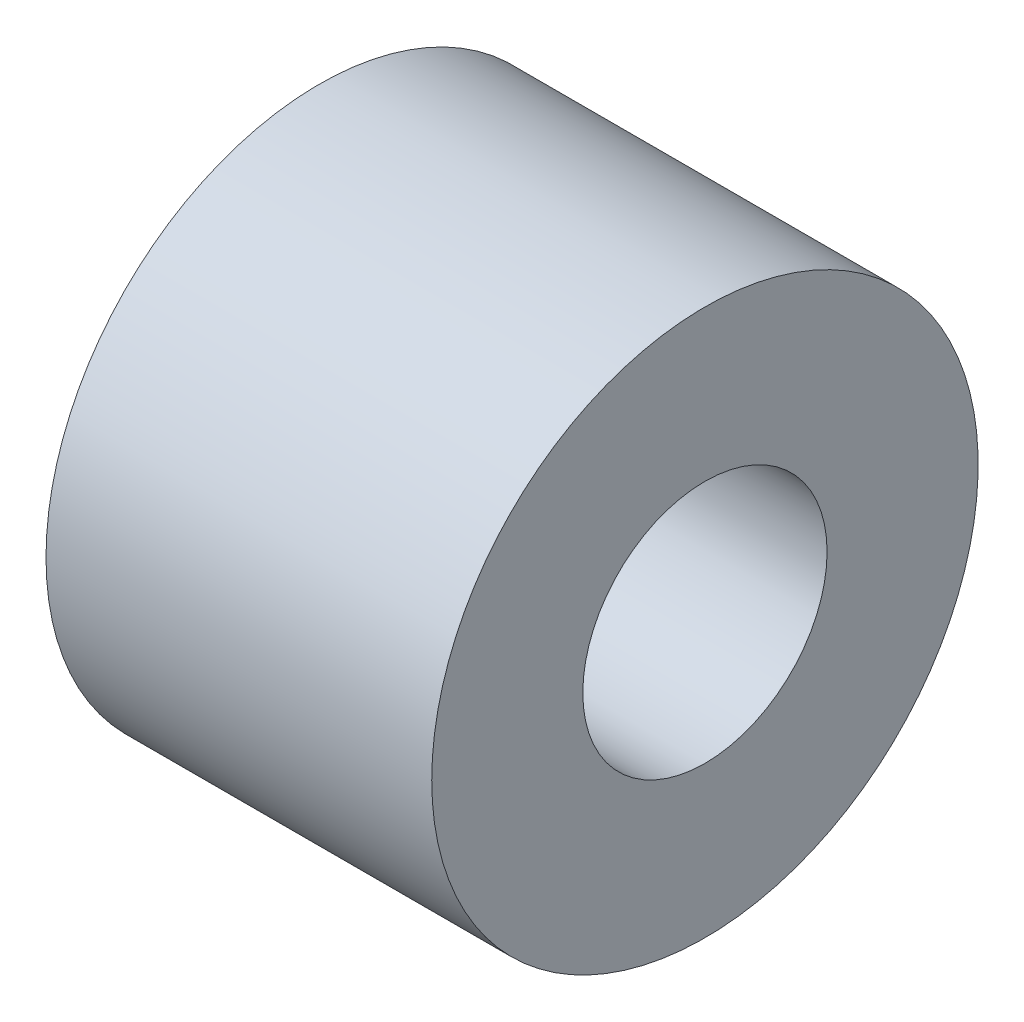
from build123d import *

# Parameters (mm, degrees)
CROQUIS1_R              = 5.3975
CROQUIS1_R_2            = 2.413
SALIENTE_EXTRUIR1_DEPTH = 3.81


with BuildPart() as part:
    # Croquis1 → Saliente-Extruir1 (new, symmetric)
    with BuildSketch(Plane(origin=(0, 0, 0), x_dir=(0, 0, -1), z_dir=(1, 0, 0))):
        with Locations(Location((0, 0, 0), (0, 0, 180))):
            Circle(CROQUIS1_R)
        with Locations(Location((0, 0, 0), (0, 0, 180))):
            Circle(CROQUIS1_R_2, mode=Mode.SUBTRACT)
    extrude(amount=SALIENTE_EXTRUIR1_DEPTH, both=True)


solid = part.part
